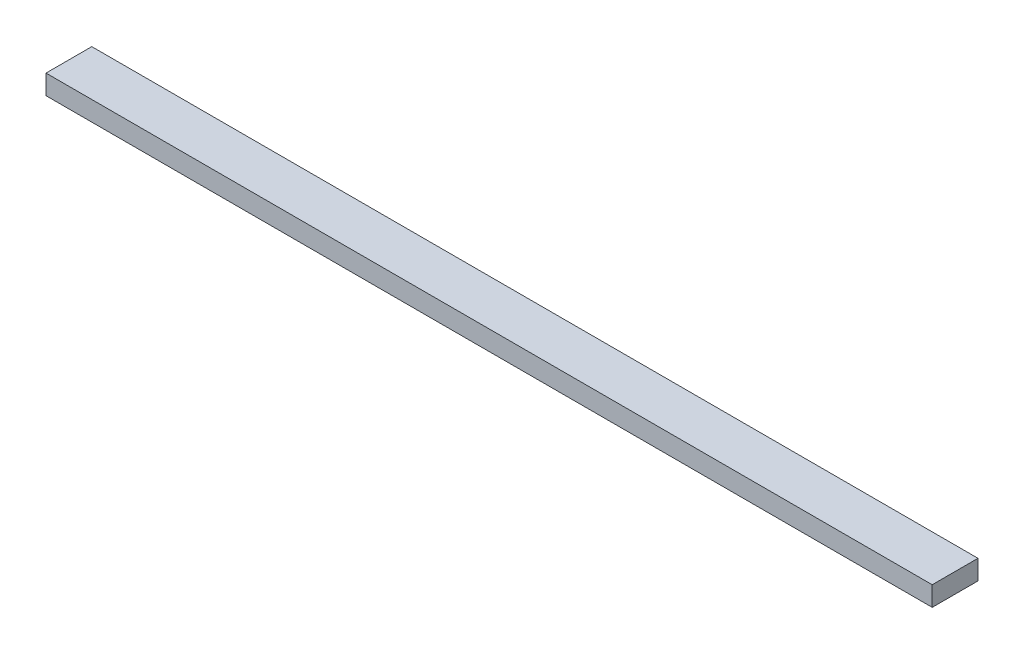
from build123d import *

# Parameters (mm, degrees)
SKETCH_1_W      = 135.5
SKETCH_1_H      = 3
EXTRUDE_1_DEPTH = 7


with BuildPart() as part:
    # 草图1 → 凸台-拉伸1 (new body)
    with BuildSketch(Plane.XY):
        Rectangle(SKETCH_1_W, SKETCH_1_H)
    extrude(amount=EXTRUDE_1_DEPTH)


solid = part.part
